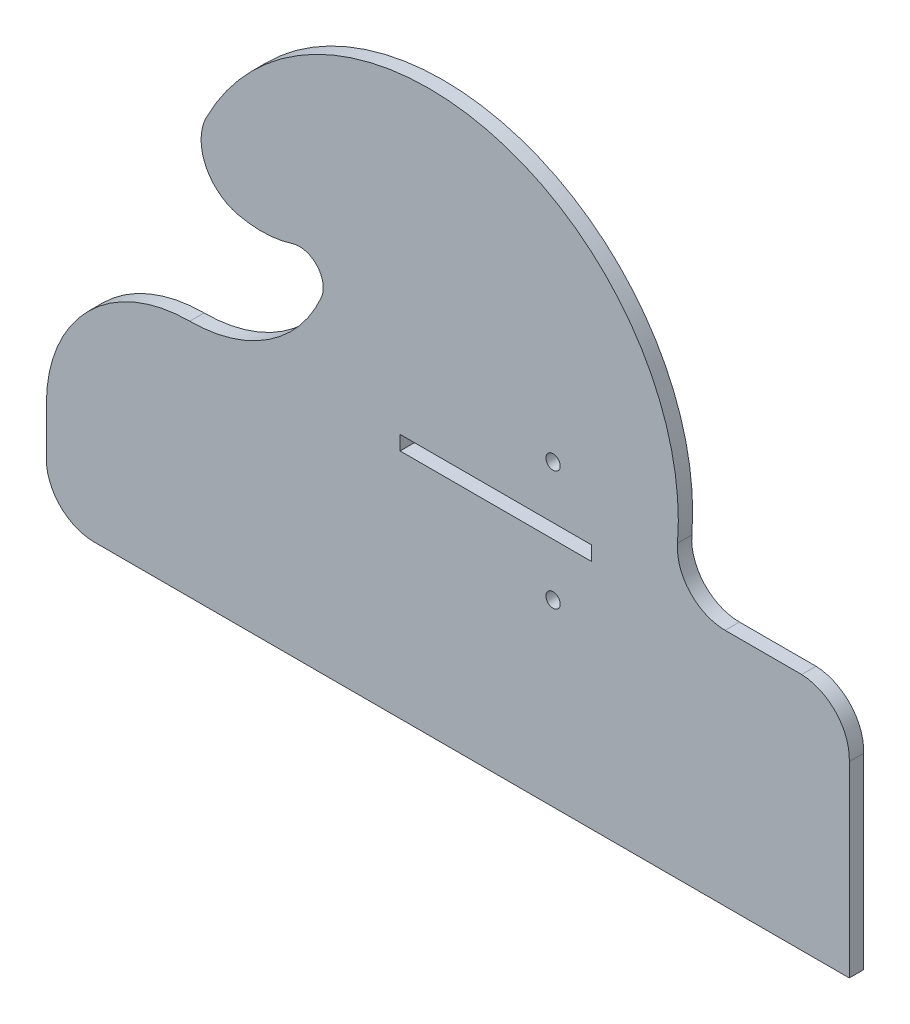
from build123d import *

# Parameters (mm, degrees)
RESSALTO_EXTRUS_O1_DEPTH = 3
ESBO_O2_W                = 40.000247185
ESBO_O2_H                = 3
CORTE_EXTRUS_O1_DEPTH    = 147.710752088
ESBO_O3_R                = 1.5
CORTE_EXTRUS_O2_DEPTH    = 147.710752088


with BuildPart() as part:
    # Esboço1 → Ressalto-extrusão1 (new body)
    with BuildSketch(Plane.XY):
        with BuildLine():
            Line((-23.696540285, -59.026029985), (126.303641818, -59.026029985))
            Line((126.303641818, -59.026029985), (134.27116449, -59.022933245))
            Line((134.27116449, -59.022933245), (134.27116449, -19.822933247))
            ThreePointArc((134.27116449, -19.822933247), (131.52375333, -12.35888539), (124.30352468, -9.022933247))
            Line((124.30352468, -9.022933247), (108.30352468, -9.022933247))
            ThreePointArc((108.30352468, -9.022933247), (100.95374961, -5.803848113), (98.335884873, 1.780905469))
            ThreePointArc((98.335884873, 1.780905469), (60.482361862, 56.216031378), (-0.245391502, 29.603776524))
            ThreePointArc((-0.245391502, 29.603776524), (-0.409038284, 20.889653739), (6.32530272, 15.356899684))
            ThreePointArc((6.32530272, 15.356899684), (12.045479144, 14.777616646), (17.711135048, 15.755538086))
            ThreePointArc((17.711135048, 15.755538086), (22.936163149, 14.335796242), (23.805019321, 8.991483891))
            ThreePointArc((23.805019321, 8.991483891), (12.741533396, -4.118425729), (-3.696722505, -9.022933247))
            ThreePointArc((-3.696722505, -9.022933247), (-24.90992594, -17.809729811), (-33.696722505, -39.022933247))
            Line((-33.696722505, -39.022933247), (-33.696540284, -49.026212146))
            ThreePointArc((-33.696540284, -49.026212146), (-30.767543693, -56.0971622), (-23.696540285, -59.026029985))
        make_face()
    extrude(amount=RESSALTO_EXTRUS_O1_DEPTH)

    # Esboço2 → Corte-extrusão1 (cut, through all)
    with BuildSketch(Plane.XY.offset(3)):
        with Locations((60.303401088, -9.022933247)):
            Rectangle(ESBO_O2_W, ESBO_O2_H)
    extrude(amount=-CORTE_EXTRUS_O1_DEPTH, mode=Mode.SUBTRACT)

    # Esboço3 → Corte-extrusão2 (cut, through all)
    with BuildSketch(Plane.XY.offset(3)):
        with Locations((72.30352468, 3.477066753)):
            Circle(ESBO_O3_R)
        with Locations((72.30352468, -21.522933247)):
            Circle(ESBO_O3_R)
    extrude(amount=-CORTE_EXTRUS_O2_DEPTH, mode=Mode.SUBTRACT)


solid = part.part
